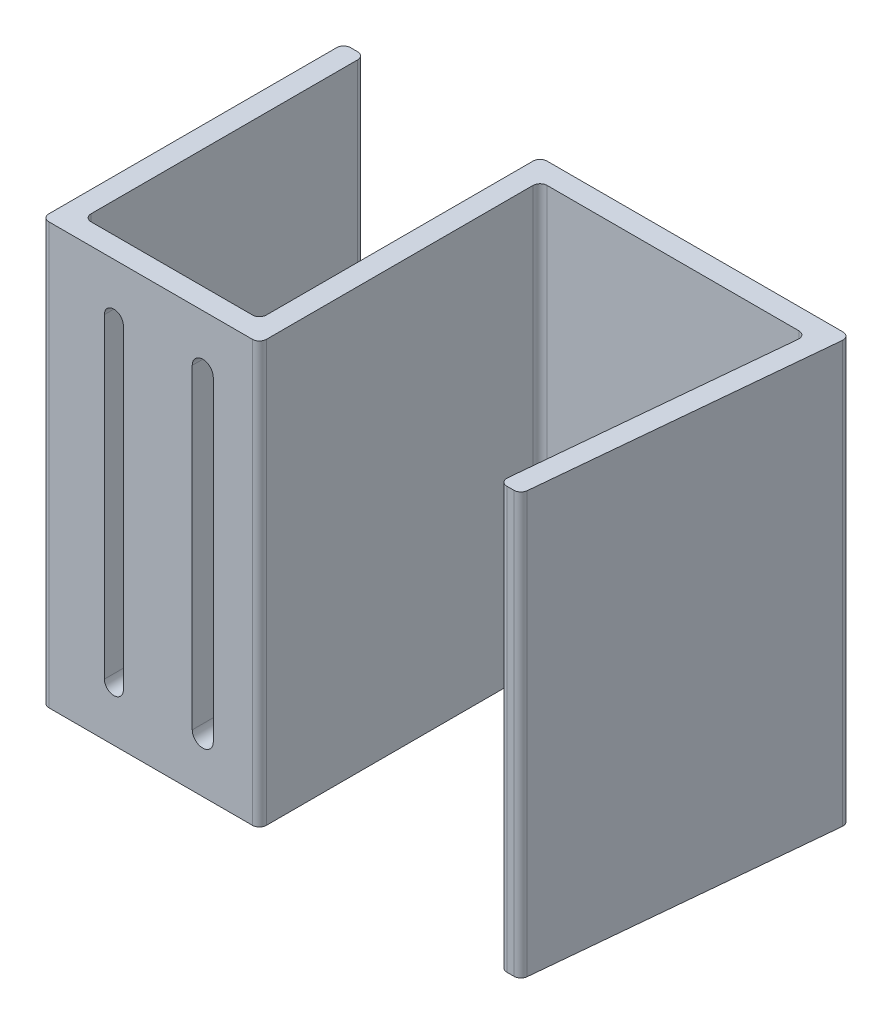
from build123d import *

# Parameters (mm, degrees)
BOSS_EXTRU_1_DEPTH           = 60
CONG_3_R                     = 1
ENL_V_MAT_EXTRU_1_DEPTH      = 60
ENL_V_MAT_EXTRU_2_DEPTH      = 90.469797558
ENL_V_MAT_EXTRU_2_DEPTH_BACK = 60


with BuildPart() as part:
    # Esquisse1 → Boss.-Extru.1 (new body)
    with BuildSketch(Plane(origin=(0, 0, 0), x_dir=(1, 0, 0), z_dir=(0, 1, 0))):
        Polygon((-21.960784314, -19.516817925), (-21.960784314, 20.483182075), (16.039215686, 20.483182075), (12.222833137, -19.516817925), (15.222833137, -19.516817925), (19.325444377, 23.483182075), (-24.960784314, 23.483182075), (-24.960784314, -16.516817925), (-49.960784314, -16.516817925), (-49.960784314, 23.483182075), (-52.960784314, 23.483182075), (-52.960784314, -19.516817925), align=None)
    extrude(amount=BOSS_EXTRU_1_DEPTH)

    # Congé3
    cong_3_edges = [part.edges().sort_by_distance(p)[0] for p in [
        (16.039215686, 30, -20.483182075),
        (-21.960784314, 30, -20.483182075),
        (-49.960784314, 30, 16.516817925),
        (-24.960784314, 30, 16.516817925),
        (-52.960784314, 30, 19.516817925),
        (-21.960784314, 30, 19.516817925),
        (15.222833137, 30, 19.516817925),
        (12.222833137, 30, 19.516817925),
        (19.325444377, 30, -23.483182075),
        (-24.960784314, 30, -23.483182075),
        (-49.960784314, 30, -23.483182075),
        (-52.960784314, 30, -23.483182075),
    ]]
    fillet(cong_3_edges, radius=CONG_3_R)

    # Esquisse2 → Enlèv. mat.-Extru.1 (cut)
    with BuildSketch(Plane(origin=(0, 0, 16.516817925), x_dir=(-1, 0, 0), z_dir=(0, 0, -1))):
        with BuildLine():
            Line((41.358290676, 7.5), (41.358290676, 52.5))
            ThreePointArc((41.358290676, 52.5), (42.711362899, 53.853072223), (44.064435122, 52.5))
            Line((44.064435122, 52.5), (44.064435122, 7.5))
            ThreePointArc((44.064435122, 7.5), (42.711362899, 6.146927777), (41.358290676, 7.5))
        make_face()
    extrude(amount=-ENL_V_MAT_EXTRU_1_DEPTH, mode=Mode.SUBTRACT)

    # Esquisse2<4> → Enlèv. mat.-Extru.2 (cut, two sides: drawn at the far end of the back side and taken through both)
    with BuildSketch(Plane(origin=(0, 0, 16.516817925), x_dir=(-1, 0, 0), z_dir=(0, 0, -1)).offset(-ENL_V_MAT_EXTRU_2_DEPTH_BACK)):
        with BuildLine():
            Line((28.538681886, 7.5), (28.538681886, 52.5))
            ThreePointArc((28.538681886, 52.5), (30.038681886, 54), (31.538681886, 52.5))
            Line((31.538681886, 52.5), (31.538681886, 7.5))
            ThreePointArc((31.538681886, 7.5), (30.038681886, 6), (28.538681886, 7.5))
        make_face()
    extrude(amount=ENL_V_MAT_EXTRU_2_DEPTH + ENL_V_MAT_EXTRU_2_DEPTH_BACK, mode=Mode.SUBTRACT)


solid = part.part
